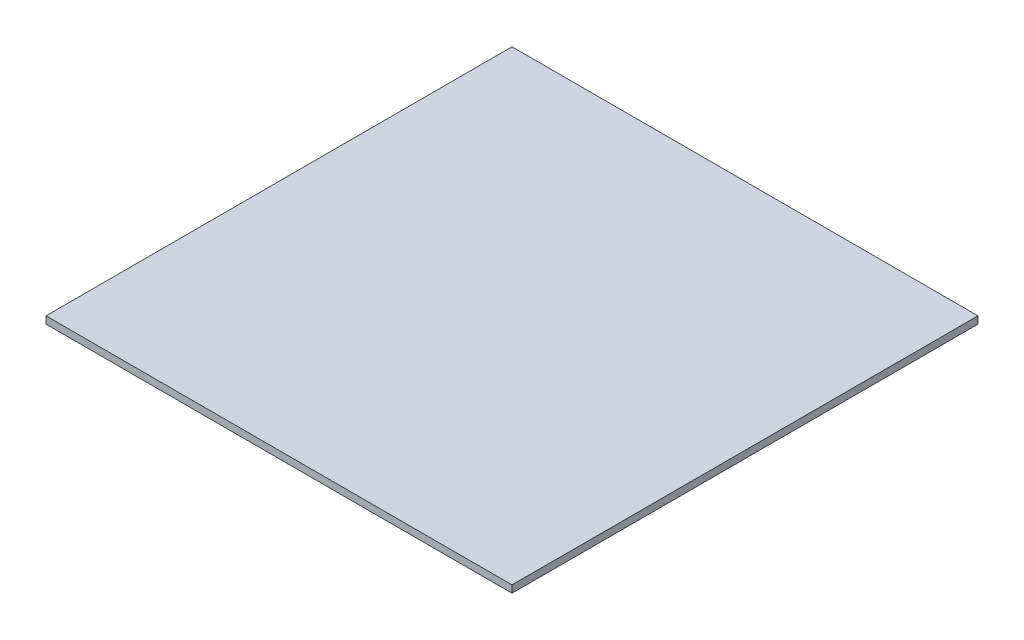
from build123d import *

# Parameters (mm, degrees)
SKIZZE1_W                       = 30000
SKIZZE1_H                       = 30000
AUFSATZ_LINEAR_AUSTRAGEN1_DEPTH = 466


with BuildPart() as part:
    # Skizze1 → Aufsatz-Linear austragen1 (new body)
    with BuildSketch(Plane(origin=(0, 0, 0), x_dir=(1, 0, 0), z_dir=(0, 1, 0))):
        with Locations((-13044.537705685, -14547.275658361)):
            Rectangle(SKIZZE1_W, SKIZZE1_H)
    extrude(amount=AUFSATZ_LINEAR_AUSTRAGEN1_DEPTH)


solid = part.part
